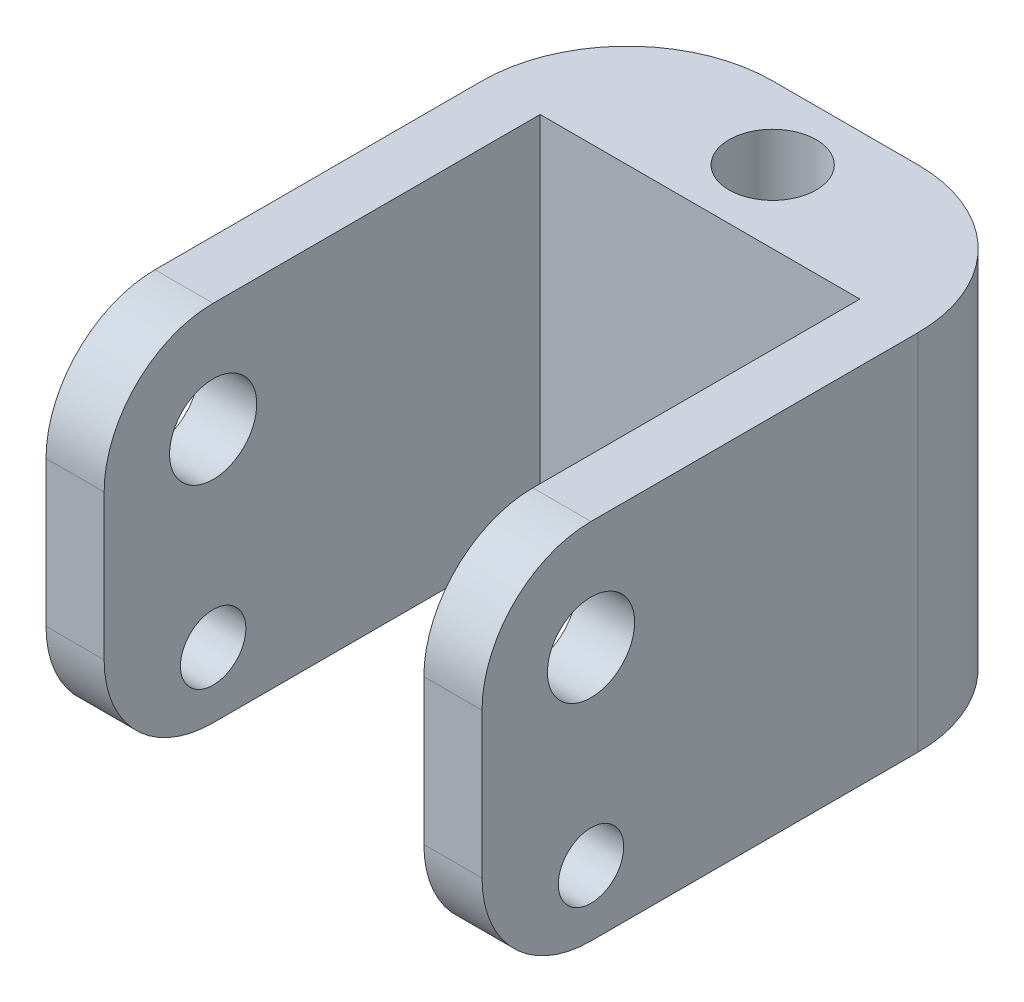
from build123d import *

# Parameters (mm, degrees)
SKETCH4_W               = 80
SKETCH4_H               = 50
SKETCH4_R               = 6
SKETCH4_R_2             = 4.5
BOSS_EXTRUDE2_DEPTH     = 30
CUT_EXTRUDE3_DEPTH      = 56.901699437
CUT_EXTRUDE3_DEPTH_BACK = 56.901699437
SKETCH5_W               = 44
SKETCH5_H               = 60
CUT_EXTRUDE4_DEPTH      = 56.901699437
CUT_EXTRUDE4_DEPTH_BACK = 56.901699437
SKETCH6_R               = 6
FILLET1_R               = 20
FILLET3_R               = 15


with BuildPart() as part:
    # Sketch4 → Boss-Extrude2 (new, symmetric)
    with BuildSketch(Plane(origin=(0, 0, 0), x_dir=(0, 0, -1), z_dir=(1, 0, 0))):
        Rectangle(SKETCH4_W, SKETCH4_H)
        with Locations((-25, 10)):
            Circle(SKETCH4_R, mode=Mode.SUBTRACT)
        with Locations((-25, -16)):
            Circle(SKETCH4_R_2, mode=Mode.SUBTRACT)
    extrude(amount=BOSS_EXTRUDE2_DEPTH, both=True)

    # Sketch5 → Cut-Extrude3 (cut, two sides: drawn at the far end of the back side and taken through both)
    with BuildSketch(Plane(origin=(0, 0, 0), x_dir=(1, 0, 0), z_dir=(0, 1, 0)).offset(-CUT_EXTRUDE3_DEPTH_BACK)):
        with Locations((0, -10)):
            Rectangle(SKETCH5_W, SKETCH5_H)
    extrude(amount=CUT_EXTRUDE3_DEPTH + CUT_EXTRUDE3_DEPTH_BACK, mode=Mode.SUBTRACT)

    # Sketch6 → Cut-Extrude4 (cut, two sides: drawn at the far end of the back side and taken through both)
    with BuildSketch(Plane(origin=(0, 0, 0), x_dir=(1, 0, 0), z_dir=(0, 1, 0)).offset(-CUT_EXTRUDE4_DEPTH_BACK)):
        with Locations(Location((0, 30, 0), (0, 0, 270))):
            Circle(SKETCH6_R)
    extrude(amount=CUT_EXTRUDE4_DEPTH + CUT_EXTRUDE4_DEPTH_BACK, mode=Mode.SUBTRACT)

    # Fillet1
    fillet1_edges = [part.edges().sort_by_distance(p)[0] for p in [
        (30, 0, -40),
        (-30, 0, -40),
    ]]
    fillet(fillet1_edges, radius=FILLET1_R)

    # Fillet3
    fillet3_edges = [part.edges().sort_by_distance(p)[0] for p in [
        (-26, -25, 40),
        (-26, 25, 40),
        (26, -25, 40),
        (26, 25, 40),
    ]]
    fillet(fillet3_edges, radius=FILLET3_R)


solid = part.part
